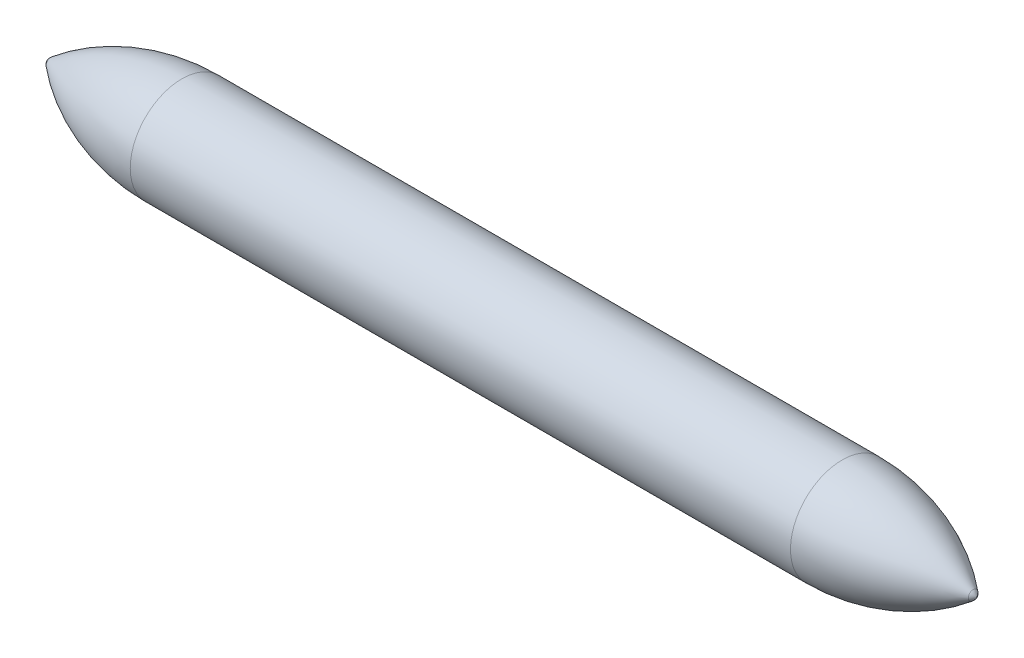
from build123d import *


with BuildPart() as part:
    # Sketch1 → Base-Revolve (revolve)
    with BuildSketch(Plane.XY, mode=Mode.PRIVATE) as base_revolve_sk:
        with BuildLine():
            Line((2.607073162, 1), (15.392323659, 1))
            ThreePointArc((15.392323659, 1), (16.739385244, 0.766536239), (17.929317067, 0.093377641))
            ThreePointArc((17.929317067, 0.093377641), (17.970203528, 0.050886147), (18, 0))
            Line((18, 0), (0, 0))
            ThreePointArc((0, 0), (0.029784345, 0.050870124), (0.070651848, 0.093352167))
            ThreePointArc((0.070651848, 0.093352167), (1.26027665, 0.766526426), (2.607073162, 1))
        make_face()
    revolve(base_revolve_sk.sketch.rotate(Axis((-10.902235099, 0, 0), (1, 0, 0)), 90), axis=Axis((-10.902235099, 0, 0), (1, 0, 0)))


solid = part.part
